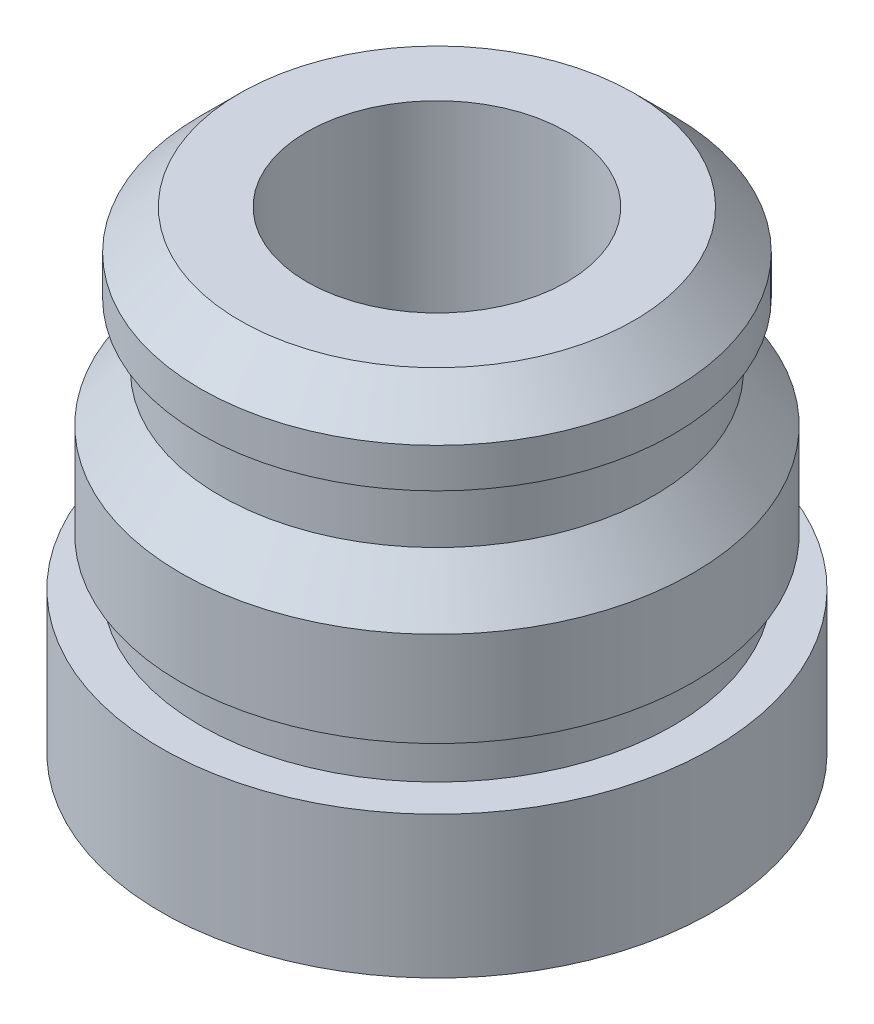
from build123d import *

# Parameters (mm, degrees)
HOLE_WIZARD_M41_D = 3.3


with BuildPart() as part:
    # Эскиз2 → Повернуть1 (revolve)
    with BuildSketch(Plane.XY, mode=Mode.PRIVATE) as revolve_1_sk:
        Polygon((1.5, -0.122080905), (3.5, -0.122080905), (3.5, 1.677919095), (3, 1.677919095), (3, 2.277919095), (3.25, 2.277919095), (3.25, 3.477919095), (2.75, 4.077919095), (2.75, 4.877919095), (3, 4.877919095), (3, 5.377919095), (2.5, 5.877919095), (1.5, 5.877919095), align=None)
    revolve(revolve_1_sk.sketch.rotate(Axis((0, 0, 0), (0, 1, 0)), 90), axis=Axis((0, 0, 0), (0, 1, 0)))

    # Отверстие обработанное метчиком M41 (through all)
    with Locations(Plane(origin=(0, -0.122080905, 0), x_dir=(-1, 0, 0), z_dir=(0, -1, 0))):
        with Locations((0, 0)):
            Hole(HOLE_WIZARD_M41_D / 2)


solid = part.part
